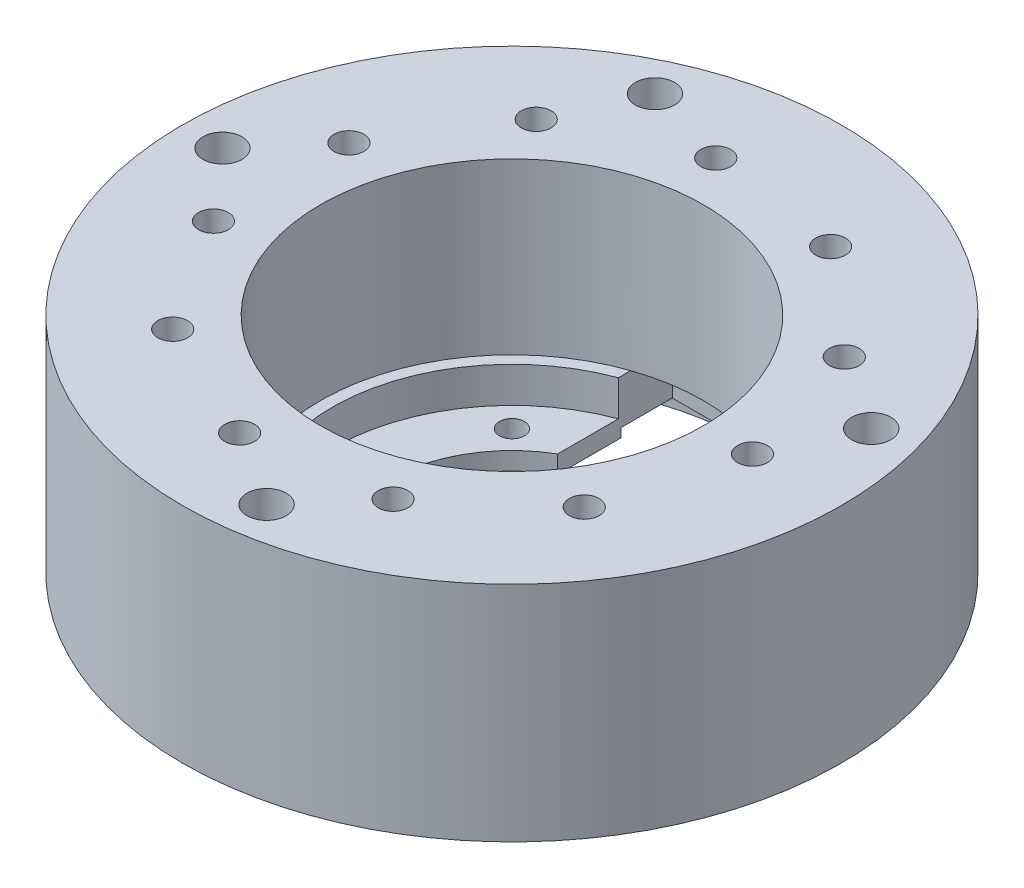
from build123d import *

# Parameters (mm, degrees)
SKETCH1_R           = 37
BOSS_EXTRUDE1_DEPTH = 25.05
SKETCH2_R           = 21.5
CUT_EXTRUDE1_DEPTH  = 19.05
SKETCH3_R           = 20.2
CUT_EXTRUDE2_DEPTH  = 4
SKETCH4_R           = 14
CUT_EXTRUDE3_DEPTH  = 58.177814754
SKETCH5_W           = 14
SKETCH5_H           = 14
CUT_EXTRUDE4_DEPTH  = 6
SKETCH6_R           = 1.4
CUT_EXTRUDE5_DEPTH  = 59.01295114
SKETCH7_R           = 1.675
CUT_EXTRUDE6_DEPTH  = 4.75
SKETCH8_R           = 2.2
CUT_EXTRUDE7_DEPTH  = 5.5
SKETCH9_R           = 26
SKETCH9_R_2         = 20.5
CUT_EXTRUDE8_DEPTH  = 1


with BuildPart() as part:
    # Sketch1 → Boss-Extrude1 (new body)
    with BuildSketch(Plane(origin=(0, 0, 0), x_dir=(1, 0, 0), z_dir=(0, 1, 0))):
        with Locations(Location((0, 0, 0), (0, 0, 270))):
            Circle(SKETCH1_R)
    extrude(amount=BOSS_EXTRUDE1_DEPTH)

    # Sketch2 → Cut-Extrude1 (cut)
    with BuildSketch(Plane(origin=(0, 25.05, 0), x_dir=(1, 0, 0), z_dir=(0, 1, 0))):
        with Locations(Location((0, 0, 0), (0, 0, 270))):
            Circle(SKETCH2_R)
    extrude(amount=-CUT_EXTRUDE1_DEPTH, mode=Mode.SUBTRACT)

    # Sketch3 → Cut-Extrude2 (cut)
    with BuildSketch(Plane(origin=(0, 6, 0), x_dir=(1, 0, 0), z_dir=(0, 1, 0))):
        with Locations(Location((0, 0, 0), (0, 0, 270))):
            Circle(SKETCH3_R)
    extrude(amount=-CUT_EXTRUDE2_DEPTH, mode=Mode.SUBTRACT)

    # Sketch4 → Cut-Extrude3 (cut, through all)
    with BuildSketch(Plane(origin=(0, 2, 0), x_dir=(1, 0, 0), z_dir=(0, 1, 0))):
        with Locations(Location((0, 0, 0), (0, 0, 270))):
            Circle(SKETCH4_R)
    extrude(amount=-CUT_EXTRUDE3_DEPTH, mode=Mode.SUBTRACT)

    # Sketch5 → Cut-Extrude4 (cut)
    with BuildSketch(Plane(origin=(0, 0, 0), x_dir=(1, 0, 0), z_dir=(0, 1, 0))):
        with Locations((0, 18)):
            Rectangle(SKETCH5_W, SKETCH5_H)
    extrude(amount=CUT_EXTRUDE4_DEPTH, mode=Mode.SUBTRACT)

    # Sketch6 → Cut-Extrude5 (cut, through all)
    with BuildSketch(Plane(origin=(0, 0, 0), x_dir=(1, 0, 0), z_dir=(0, 1, 0))):
        with Locations(Location((12.021, 12.021, 0), (0, 0, 270))):
            Circle(SKETCH6_R)
        with Locations(Location((12.021, -12.021, 0), (0, 0, 270))):
            Circle(SKETCH6_R)
        with Locations(Location((-12.021, -12.021, 0), (0, 0, 270))):
            Circle(SKETCH6_R)
        with Locations(Location((-12.021, 12.021, 0), (0, 0, 270))):
            Circle(SKETCH6_R)
    extrude(amount=CUT_EXTRUDE5_DEPTH, mode=Mode.SUBTRACT)

    # Sketch7 → Cut-Extrude6 (cut)
    with BuildSketch(Plane(origin=(0, 25.05, 0), x_dir=(1, 0, 0), z_dir=(0, 1, 0))):
        with Locations(Location((27, 0, 0), (0, 0, 270))):
            Circle(SKETCH7_R)
        with Locations(Location((22.713845386, -14.597302071, 0), (0, 0, 270))):
            Circle(SKETCH7_R)
        with Locations(Location((11.216205351, -24.560063875, 0), (0, 0, 270))):
            Circle(SKETCH7_R)
        with Locations(Location((-3.842500633, -26.725178931, 0), (0, 0, 270))):
            Circle(SKETCH7_R)
        with Locations(Location((-17.681239817, -20.405238508, 0), (0, 0, 270))):
            Circle(SKETCH7_R)
        with Locations(Location((-25.906310288, -7.606779035, 0), (0, 0, 270))):
            Circle(SKETCH7_R)
        with Locations(Location((-25.906310288, 7.606779035, 0), (0, 0, 270))):
            Circle(SKETCH7_R)
        with Locations(Location((-17.681239817, 20.405238508, 0), (0, 0, 270))):
            Circle(SKETCH7_R)
        with Locations(Location((-3.842500633, 26.725178931, 0), (0, 0, 270))):
            Circle(SKETCH7_R)
        with Locations(Location((11.216205351, 24.560063875, 0), (0, 0, 270))):
            Circle(SKETCH7_R)
        with Locations(Location((22.713845386, 14.597302071, 0), (0, 0, 270))):
            Circle(SKETCH7_R)
    extrude(amount=-CUT_EXTRUDE6_DEPTH, mode=Mode.SUBTRACT)

    # Sketch8 → Cut-Extrude7 (cut)
    with BuildSketch(Plane(origin=(0, 25.05, 0), x_dir=(1, 0, 0), z_dir=(0, 1, 0))):
        with Locations(Location((31.184102699, 9.154328969, 0), (0, 0, 270))):
            Circle(SKETCH8_R)
        with Locations(Location((-13.503333209, 29.56196868, 0), (0, 0, 270))):
            Circle(SKETCH8_R)
        with Locations(Location((-32.5, 0, 0), (0, 0, 270))):
            Circle(SKETCH8_R)
        with Locations(Location((4.624211408, -32.169343619, 0), (0, 0, 270))):
            Circle(SKETCH8_R)
    extrude(amount=-CUT_EXTRUDE7_DEPTH, mode=Mode.SUBTRACT)

    # Sketch9 → Cut-Extrude8 (cut)
    with BuildSketch(Plane(origin=(0, 0, 0), x_dir=(1, 0, 0), z_dir=(0, 1, 0))):
        with Locations(Location((0, 0, 0), (0, 0, 270))):
            Circle(SKETCH9_R)
        Circle(SKETCH9_R_2, mode=Mode.SUBTRACT)
    extrude(amount=CUT_EXTRUDE8_DEPTH, mode=Mode.SUBTRACT)


solid = part.part
